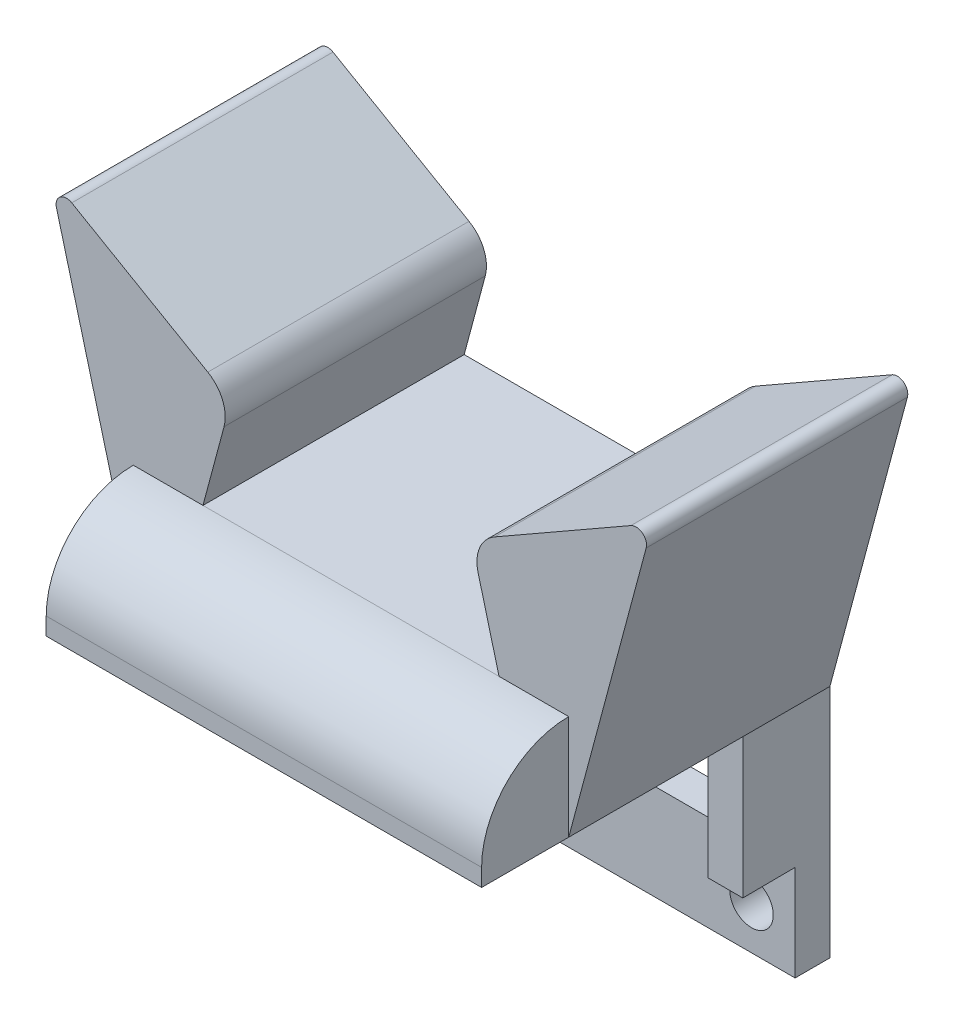
from build123d import *

# Parameters (mm, degrees)
BOSS_EXTRUDE1_DEPTH  = 16
SKETCH3_W            = 25
SKETCH3_H            = 6
BOSS_EXTRUDE2_DEPTH  = 2
SKETCH6_W            = 25
SKETCH6_H            = 15
BOSS_EXTRUDE3_DEPTH  = 2
SKETCH7_W            = 21
SKETCH7_H            = 8
CUT_EXTRUDE1_DEPTH   = 2
SKETCH10_W           = 25
SKETCH10_H           = 4.5
BOSS_EXTRUDE4_DEPTH  = 2
CUT_EXTRUDE2_DEPTH   = 3
FILLET1_R            = 5
BOSS_EXTRUDE7_DEPTH  = 15
BOSS_EXTRUDE8_DEPTH  = 2
BOSS_EXTRUDE9_DEPTH  = 2
FILLET4_R            = 2
FILLET5_R            = 0.6
SKETCH16_W           = 3
SKETCH16_H           = 8.020078622
BOSS_EXTRUDE10_DEPTH = 2
BOSS_EXTRUDE11_DEPTH = 2
SKETCH18_W           = 21
SKETCH18_H           = 13
CUT_EXTRUDE3_DEPTH   = 4


with BuildPart() as part:
    # Sketch1 → Boss-Extrude1 (new body)
    with BuildSketch(Plane.XY):
        Polygon((23, 2), (-2, 2), (-2, -4), (0, -4), (0, 0), (21, 0), (21, -4), (23, -4), align=None)
    extrude(amount=BOSS_EXTRUDE1_DEPTH)

    # Sketch3 → Boss-Extrude2 (add)
    with BuildSketch(Plane.XY.offset(16)):
        with Locations((10.5, -1)):
            Rectangle(SKETCH3_W, SKETCH3_H)
    extrude(amount=BOSS_EXTRUDE2_DEPTH)

    # Sketch6 → Boss-Extrude3 (add)
    with BuildSketch(Plane(origin=(0, 0, 0), x_dir=(-1, 0, 0), z_dir=(0, 0, -1))):
        with Locations((-10.5, -5.5)):
            Rectangle(SKETCH6_W, SKETCH6_H)
    extrude(amount=BOSS_EXTRUDE3_DEPTH)

    # Sketch7 → Cut-Extrude1 (cut)
    with BuildSketch(Plane(origin=(0, 0, -2), x_dir=(-1, 0, 0), z_dir=(0, 0, -1))):
        with Locations((-10.5, -8)):
            Rectangle(SKETCH7_W, SKETCH7_H)
    extrude(amount=-CUT_EXTRUDE1_DEPTH, mode=Mode.SUBTRACT)

    # Sketch10 → Boss-Extrude4 (add)
    with BuildSketch(Plane(origin=(0, 0, -2), x_dir=(-1, 0, 0), z_dir=(0, 0, -1))):
        with Locations((-10.5, -15.25)):
            Rectangle(SKETCH10_W, SKETCH10_H)
    extrude(amount=-BOSS_EXTRUDE4_DEPTH)

    # Sketch11 → Cut-Extrude2 (cut)
    with BuildSketch(Plane(origin=(0, 0, -2), x_dir=(-1, 0, 0), z_dir=(0, 0, -1))):
        with BuildLine():
            ThreePointArc((-19.246874512, -15), (-19.813649388, -13.953241465), (-21, -13.855725233))
            Line((-21, -13.855725233), (-21, -16.144274767))
            ThreePointArc((-21, -16.144274767), (-19.813649388, -16.046758535), (-19.246874512, -15))
        make_face()
        with BuildLine():
            Line((-21, -16.144274767), (-21, -13.855725233))
            ThreePointArc((-21, -13.855725233), (-21.746874512, -15), (-21, -16.144274767))
        make_face()
        with BuildLine():
            ThreePointArc((0.753125488, -15), (0.548016186, -14.313921703), (0, -13.852997071))
            Line((0, -13.852997071), (0, -16.147002929))
            ThreePointArc((0, -16.147002929), (0.548016186, -15.686078297), (0.753125488, -15))
        make_face()
        with BuildLine():
            Line((0, -16.147002929), (0, -13.852997071))
            ThreePointArc((0, -13.852997071), (-1.746874512, -15), (0, -16.147002929))
        make_face()
    extrude(amount=-CUT_EXTRUDE2_DEPTH, mode=Mode.SUBTRACT)

    # Fillet1
    fillet1_edges = [part.edges().sort_by_distance(p)[0] for p in [
        (10.5, 2, 18),
    ]]
    fillet(fillet1_edges, radius=FILLET1_R)

    # Sketch13 → Boss-Extrude7 (add)
    with BuildSketch(Plane(origin=(0, 0, -2), x_dir=(-1, 0, 0), z_dir=(0, 0, -1))):
        Polygon((-21, -4), (-23, -4), (-27.823085464, 14), (-17.406964655, 8.041440838), (-19, 2), (-2, 2), (-3.607695155, 8), (6.784609691, 14), (2, -4), (0, -4), align=None)
        Polygon((-22.232673012, -3), (-26.235818051, 11.939940677), (-18.569558802, 7.554444375), (-20.297865317, 1), (-0.696774627, 1), (-2.44317049, 7.51763809), (5.199725285, 11.930266023), (1.231086646, -3), (0, -3), (-21, -3), align=None, mode=Mode.SUBTRACT)
    extrude(amount=-BOSS_EXTRUDE7_DEPTH)

    # Sketch14 → Boss-Extrude8 (add)
    with BuildSketch(Plane(origin=(0, 0, -2), x_dir=(-1, 0, 0), z_dir=(0, 0, -1))):
        Polygon((-27.823085464, 14), (-23, -4), (-19, 2), (-17.406964655, 8.041440838), align=None)
        Polygon((-2, 2), (2, -4), (6.784609691, 14), (-3.607695155, 8), align=None)
    extrude(amount=-BOSS_EXTRUDE8_DEPTH)

    # Sketch15 → Boss-Extrude9 (add)
    with BuildSketch(Plane.XY.offset(13)):
        Polygon((-6.784609691, 14), (-2, -4), (2, 2), (3.607695155, 8), align=None)
        Polygon((19, 2), (23, -4), (27.823085464, 14), (17.406964655, 8.041440838), align=None)
    extrude(amount=-BOSS_EXTRUDE9_DEPTH)

    # Fillet4
    fillet4_edges = [part.edges().sort_by_distance(p)[0] for p in [
        (17.406964655, 8.041440838, 5.5),
        (3.607695155, 8, 5.5),
    ]]
    fillet(fillet4_edges, radius=FILLET4_R)

    # Fillet5
    fillet5_edges = [part.edges().sort_by_distance(p)[0] for p in [
        (27.823085464, 14, 5.5),
        (-6.784609691, 14, 5.5),
    ]]
    fillet(fillet5_edges, radius=FILLET5_R)

    # Sketch16 → Boss-Extrude10 (add)
    with BuildSketch(Plane.ZY.offset(2)):
        with Locations((1.5, -8.010039311)):
            Rectangle(SKETCH16_W, SKETCH16_H)
    extrude(amount=-BOSS_EXTRUDE10_DEPTH)

    # Sketch17 → Boss-Extrude11 (add)
    with BuildSketch(Plane(origin=(23, 0, 0), x_dir=(0, 0, -1), z_dir=(1, 0, 0))):
        Polygon((0, -12), (-3, -12.020078622), (-3, -4), (0, -4), align=None)
    extrude(amount=-BOSS_EXTRUDE11_DEPTH)

    # Sketch18 → Cut-Extrude3 (cut)
    with BuildSketch(Plane.XZ.offset(4)):
        with Locations((10.5, 6.5)):
            Rectangle(SKETCH18_W, SKETCH18_H)
    extrude(amount=-CUT_EXTRUDE3_DEPTH, mode=Mode.SUBTRACT)


solid = part.part
